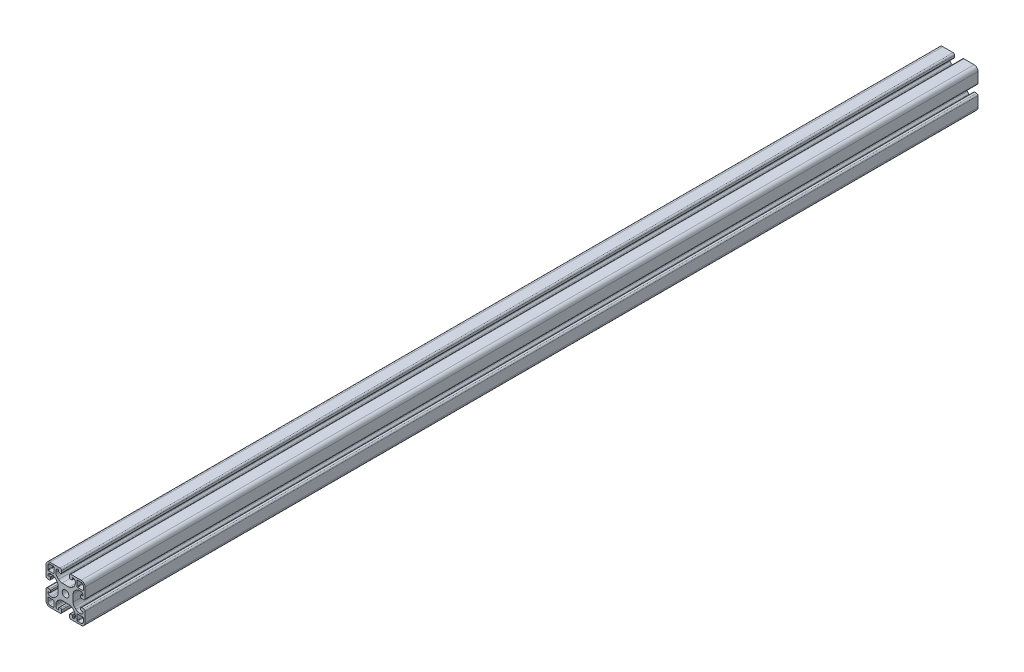
from build123d import *

# Parameters (mm, degrees)
ESQUISSE1_R        = 3.4
BOSS_EXTRU_1_DEPTH = 915


with BuildPart() as part:
    # Esquisse1 → Boss.-Extru.1 (new body)
    with BuildSketch(Plane(origin=(0, 0, -30), x_dir=(-1, 0, 0), z_dir=(0, 0, -1))):
        with BuildLine():
            Line((-4.5, 15), (-4.5, 13.5))
            ThreePointArc((-4.5, 13.5), (-4.353553391, 13.146446609), (-4, 13))
            Line((-4, 13), (-2.5, 13))
            ThreePointArc((-2.5, 13), (-2.146446609, 12.853553391), (-2, 12.5))
            ThreePointArc((-2, 12.5), (-2.732233047, 10.732233047), (-4.5, 10))
            Line((-4.5, 10), (-5.807611845, 10))
            ThreePointArc((-5.807611845, 10), (-7.721029006, 10.380602337), (-9.343145751, 11.464466094))
            Line((-9.343145751, 11.464466094), (-10.785533906, 12.906854249))
            ThreePointArc((-10.785533906, 12.906854249), (-11.869397663, 14.528970994), (-12.25, 16.442388155))
            Line((-12.25, 16.442388155), (-12.25, 23.557611845))
            ThreePointArc((-12.25, 23.557611845), (-11.869397663, 25.471029006), (-10.785533906, 27.093145751))
            Line((-10.785533906, 27.093145751), (-9.343145751, 28.535533906))
            ThreePointArc((-9.343145751, 28.535533906), (-7.721029006, 29.619397663), (-5.807611845, 30))
            Line((-5.807611845, 30), (-4.5, 30))
            ThreePointArc((-4.5, 30), (-2.732233047, 29.267766953), (-2, 27.5))
            ThreePointArc((-2, 27.5), (-2.146446609, 27.146446609), (-2.5, 27))
            Line((-2.5, 27), (-4, 27))
            ThreePointArc((-4, 27), (-4.353553391, 26.853553391), (-4.5, 26.5))
            Line((-4.5, 26.5), (-4.5, 25))
            ThreePointArc((-4.5, 25), (-4.207106781, 24.292893219), (-3.5, 24))
            Line((-3.5, 24), (-1.5, 24))
            ThreePointArc((-1.5, 24), (-0.439339828, 24.439339828), (0, 25.5))
            Line((0, 25.5), (0, 36))
            ThreePointArc((0, 36), (-1.171572875, 38.828427125), (-4, 40))
            Line((-4, 40), (-14.5, 40))
            ThreePointArc((-14.5, 40), (-15.560660172, 39.560660172), (-16, 38.5))
            Line((-16, 38.5), (-16, 36.5))
            ThreePointArc((-16, 36.5), (-15.707106781, 35.792893219), (-15, 35.5))
            Line((-15, 35.5), (-13.5, 35.5))
            ThreePointArc((-13.5, 35.5), (-13.146446609, 35.646446609), (-13, 36))
            Line((-13, 36), (-13, 37.5))
            ThreePointArc((-13, 37.5), (-12.853553391, 37.853553391), (-12.5, 38))
            ThreePointArc((-12.5, 38), (-10.732233047, 37.267766953), (-10, 35.5))
            Line((-10, 35.5), (-10, 34.192388155))
            ThreePointArc((-10, 34.192388155), (-10.380602337, 32.278970994), (-11.464466094, 30.656854249))
            Line((-11.464466094, 30.656854249), (-12.906854249, 29.214466094))
            ThreePointArc((-12.906854249, 29.214466094), (-14.528970994, 28.130602337), (-16.442388155, 27.75))
            Line((-16.442388155, 27.75), (-23.557611845, 27.75))
            ThreePointArc((-23.557611845, 27.75), (-25.471029006, 28.130602337), (-27.093145751, 29.214466094))
            Line((-27.093145751, 29.214466094), (-28.535533906, 30.656854249))
            ThreePointArc((-28.535533906, 30.656854249), (-29.619397663, 32.278970994), (-30, 34.192388155))
            Line((-30, 34.192388155), (-30, 35.5))
            ThreePointArc((-30, 35.5), (-29.267766953, 37.267766953), (-27.5, 38))
            ThreePointArc((-27.5, 38), (-27.146446609, 37.853553391), (-27, 37.5))
            Line((-27, 37.5), (-27, 36))
            ThreePointArc((-27, 36), (-26.853553391, 35.646446609), (-26.5, 35.5))
            Line((-26.5, 35.5), (-25, 35.5))
            ThreePointArc((-25, 35.5), (-24.292893219, 35.792893219), (-24, 36.5))
            Line((-24, 36.5), (-24, 38.5))
            ThreePointArc((-24, 38.5), (-24.439339828, 39.560660172), (-25.5, 40))
            Line((-25.5, 40), (-36, 40))
            ThreePointArc((-36, 40), (-38.828427125, 38.828427125), (-40, 36))
            Line((-40, 36), (-40, 25.5))
            ThreePointArc((-40, 25.5), (-39.560660172, 24.439339828), (-38.5, 24))
            Line((-38.5, 24), (-36.5, 24))
            ThreePointArc((-36.5, 24), (-35.792893219, 24.292893219), (-35.5, 25))
            Line((-35.5, 25), (-35.5, 26.5))
            ThreePointArc((-35.5, 26.5), (-35.646446609, 26.853553391), (-36, 27))
            Line((-36, 27), (-37.5, 27))
            ThreePointArc((-37.5, 27), (-37.853553391, 27.146446609), (-38, 27.5))
            ThreePointArc((-38, 27.5), (-37.267766953, 29.267766953), (-35.5, 30))
            Line((-35.5, 30), (-34.192388155, 30))
            ThreePointArc((-34.192388155, 30), (-32.278970994, 29.619397663), (-30.656854249, 28.535533906))
            Line((-30.656854249, 28.535533906), (-29.214466094, 27.093145751))
            ThreePointArc((-29.214466094, 27.093145751), (-28.130602337, 25.471029006), (-27.75, 23.557611845))
            Line((-27.75, 23.557611845), (-27.75, 16.442388155))
            ThreePointArc((-27.75, 16.442388155), (-28.130602337, 14.528970994), (-29.214466094, 12.906854249))
            Line((-29.214466094, 12.906854249), (-30.656854249, 11.464466094))
            ThreePointArc((-30.656854249, 11.464466094), (-32.278970994, 10.380602337), (-34.192388155, 10))
            Line((-34.192388155, 10), (-35.5, 10))
            ThreePointArc((-35.5, 10), (-37.267766953, 10.732233047), (-38, 12.5))
            ThreePointArc((-38, 12.5), (-37.853553391, 12.853553391), (-37.5, 13))
            Line((-37.5, 13), (-36, 13))
            ThreePointArc((-36, 13), (-35.646446609, 13.146446609), (-35.5, 13.5))
            Line((-35.5, 13.5), (-35.5, 15))
            ThreePointArc((-35.5, 15), (-35.792893219, 15.707106781), (-36.5, 16))
            Line((-36.5, 16), (-38.5, 16))
            ThreePointArc((-38.5, 16), (-39.560660172, 15.560660172), (-40, 14.5))
            Line((-40, 14.5), (-40, 4))
            ThreePointArc((-40, 4), (-38.828427125, 1.171572875), (-36, 0))
            Line((-36, 0), (-25.5, 0))
            ThreePointArc((-25.5, 0), (-24.439339828, 0.439339828), (-24, 1.5))
            Line((-24, 1.5), (-24, 3.5))
            ThreePointArc((-24, 3.5), (-24.292893219, 4.207106781), (-25, 4.5))
            Line((-25, 4.5), (-26.5, 4.5))
            ThreePointArc((-26.5, 4.5), (-26.853553391, 4.353553391), (-27, 4))
            Line((-27, 4), (-27, 2.5))
            ThreePointArc((-27, 2.5), (-27.146446609, 2.146446609), (-27.5, 2))
            ThreePointArc((-27.5, 2), (-29.267766953, 2.732233047), (-30, 4.5))
            Line((-30, 4.5), (-30, 5.807611845))
            ThreePointArc((-30, 5.807611845), (-29.619397663, 7.721029006), (-28.535533906, 9.343145751))
            Line((-28.535533906, 9.343145751), (-27.093145751, 10.785533906))
            ThreePointArc((-27.093145751, 10.785533906), (-25.471029006, 11.869397663), (-23.557611845, 12.25))
            Line((-23.557611845, 12.25), (-16.442388155, 12.25))
            ThreePointArc((-16.442388155, 12.25), (-14.528970994, 11.869397663), (-12.906854249, 10.785533906))
            Line((-12.906854249, 10.785533906), (-11.464466094, 9.343145751))
            ThreePointArc((-11.464466094, 9.343145751), (-10.380602337, 7.721029006), (-10, 5.807611845))
            Line((-10, 5.807611845), (-10, 4.5))
            ThreePointArc((-10, 4.5), (-10.732233047, 2.732233047), (-12.5, 2))
            ThreePointArc((-12.5, 2), (-12.853553391, 2.146446609), (-13, 2.5))
            Line((-13, 2.5), (-13, 4))
            ThreePointArc((-13, 4), (-13.146446609, 4.353553391), (-13.5, 4.5))
            Line((-13.5, 4.5), (-15, 4.5))
            ThreePointArc((-15, 4.5), (-15.707106781, 4.207106781), (-16, 3.5))
            Line((-16, 3.5), (-16, 1.5))
            ThreePointArc((-16, 1.5), (-15.560660172, 0.439339828), (-14.5, 0))
            Line((-14.5, 0), (-4, 0))
            ThreePointArc((-4, 0), (-1.171572875, 1.171572875), (0, 4))
            Line((0, 4), (0, 14.5))
            ThreePointArc((0, 14.5), (-0.439339828, 15.560660172), (-1.5, 16))
            Line((-1.5, 16), (-3.5, 16))
            ThreePointArc((-3.5, 16), (-4.207106781, 15.707106781), (-4.5, 15))
        make_face()
        with Locations((-20, 20)):
            Circle(ESQUISSE1_R, mode=Mode.SUBTRACT)
        with BuildLine():
            Line((-4, 1.8), (-7.7, 1.8))
            ThreePointArc((-7.7, 1.8), (-8.053553391, 1.946446609), (-8.2, 2.3))
            Line((-8.2, 2.3), (-8.2, 7.7))
            ThreePointArc((-8.2, 7.7), (-8.053553391, 8.053553391), (-7.7, 8.2))
            Line((-7.7, 8.2), (-2.3, 8.2))
            ThreePointArc((-2.3, 8.2), (-1.946446609, 8.053553391), (-1.8, 7.7))
            Line((-1.8, 7.7), (-1.8, 4))
            ThreePointArc((-1.8, 4), (-2.444365081, 2.444365081), (-4, 1.8))
        make_face(mode=Mode.SUBTRACT)
        with BuildLine():
            Line((-38.2, 4), (-38.2, 7.7))
            ThreePointArc((-38.2, 7.7), (-38.053553391, 8.053553391), (-37.7, 8.2))
            Line((-37.7, 8.2), (-32.3, 8.2))
            ThreePointArc((-32.3, 8.2), (-31.946446609, 8.053553391), (-31.8, 7.7))
            Line((-31.8, 7.7), (-31.8, 2.3))
            ThreePointArc((-31.8, 2.3), (-31.946446609, 1.946446609), (-32.3, 1.8))
            Line((-32.3, 1.8), (-36, 1.8))
            ThreePointArc((-36, 1.8), (-37.555634919, 2.444365081), (-38.2, 4))
        make_face(mode=Mode.SUBTRACT)
        with BuildLine():
            Line((-36, 38.2), (-32.3, 38.2))
            ThreePointArc((-32.3, 38.2), (-31.946446609, 38.053553391), (-31.8, 37.7))
            Line((-31.8, 37.7), (-31.8, 32.3))
            ThreePointArc((-31.8, 32.3), (-31.946446609, 31.946446609), (-32.3, 31.8))
            Line((-32.3, 31.8), (-37.7, 31.8))
            ThreePointArc((-37.7, 31.8), (-38.053553391, 31.946446609), (-38.2, 32.3))
            Line((-38.2, 32.3), (-38.2, 36))
            ThreePointArc((-38.2, 36), (-37.555634919, 37.555634919), (-36, 38.2))
        make_face(mode=Mode.SUBTRACT)
        with BuildLine():
            Line((-1.8, 36), (-1.8, 32.3))
            ThreePointArc((-1.8, 32.3), (-1.946446609, 31.946446609), (-2.3, 31.8))
            Line((-2.3, 31.8), (-7.7, 31.8))
            ThreePointArc((-7.7, 31.8), (-8.053553391, 31.946446609), (-8.2, 32.3))
            Line((-8.2, 32.3), (-8.2, 37.7))
            ThreePointArc((-8.2, 37.7), (-8.053553391, 38.053553391), (-7.7, 38.2))
            Line((-7.7, 38.2), (-4, 38.2))
            ThreePointArc((-4, 38.2), (-2.444365081, 37.555634919), (-1.8, 36))
        make_face(mode=Mode.SUBTRACT)
    extrude(amount=-BOSS_EXTRU_1_DEPTH)


solid = part.part
